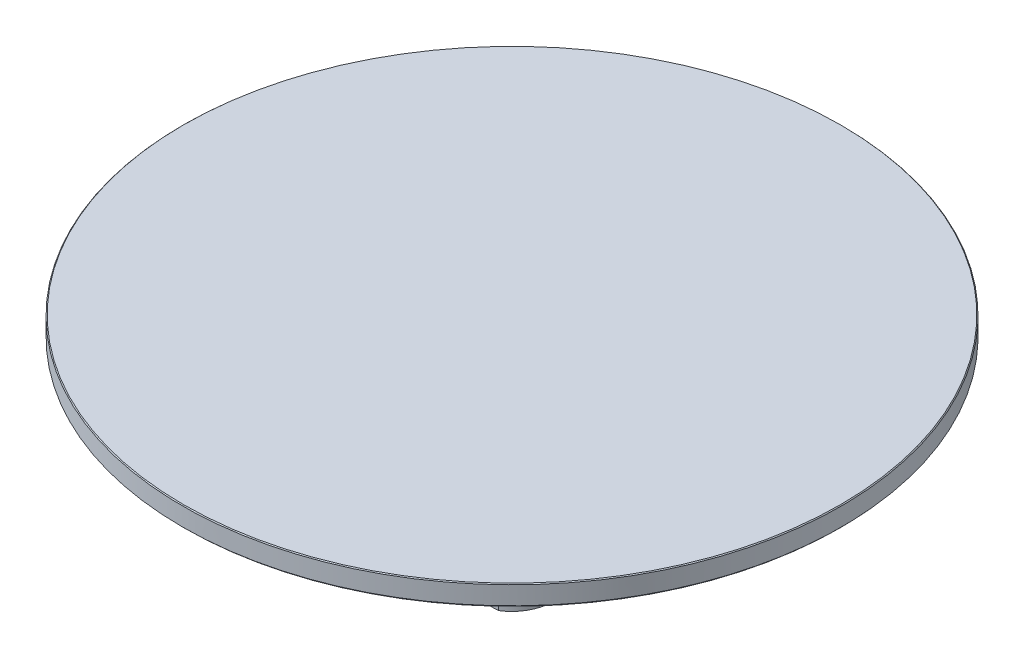
from build123d import *

# Parameters (mm, degrees)
SKETCH_1_R          = 79.5
EXTRUDE_1_DEPTH     = 5
SKETCH_2_R          = 9.9
EXTRUDE_2_DEPTH     = 50
CHAMFER_1_SIZE      = 0.2
CUT_EXTRUDE_1_DEPTH = 50
CHAMFER_2_SIZE      = 0.4


with BuildPart() as part:
    # 草图1 → 凸台-拉伸1 (new body)
    with BuildSketch(Plane(origin=(0, 0, 0), x_dir=(1, 0, 0), z_dir=(0, 1, 0))):
        with Locations(Location((0, 0, 0), (0, 0, 270))):
            Circle(SKETCH_1_R)
    extrude(amount=EXTRUDE_1_DEPTH)

    # 草图2 → 凸台-拉伸2 (add)
    with BuildSketch(Plane(origin=(0, 0, 0), x_dir=(-1, 0, 0), z_dir=(0, -1, 0))):
        with Locations(Location((0, 0, 0), (0, 0, 270))):
            Circle(SKETCH_2_R)
    extrude(amount=EXTRUDE_2_DEPTH)

    # 倒角1
    chamfer_1_edges = [part.edges().sort_by_distance(p)[0] for p in [
        (0, 5, -79.5),
    ]]
    chamfer(chamfer_1_edges, length=CHAMFER_1_SIZE)

    # 草图3 → 切除-拉伸1 (cut)
    with BuildSketch(Plane(origin=(0, -50, 0), x_dir=(-1, 0, 0), z_dir=(0, -1, 0))):
        with BuildLine():
            Line((4.835339801, -8.753255909), (-5.365688092, -8.438565713))
            ThreePointArc((-5.365688092, -8.438565713), (-0.308342029, -9.995245129), (4.835339801, -8.753255909))
        make_face()
    extrude(amount=-CUT_EXTRUDE_1_DEPTH, mode=Mode.SUBTRACT)

    # 倒角2
    chamfer_2_edges = [part.edges().sort_by_distance(p)[0] for p in [
        (0.265174145, 0, 8.595910811),
        (0, 0, -79.5),
        (-0.305258609, 0, -9.895292678),
    ]]
    chamfer(chamfer_2_edges, length=CHAMFER_2_SIZE)


solid = part.part
